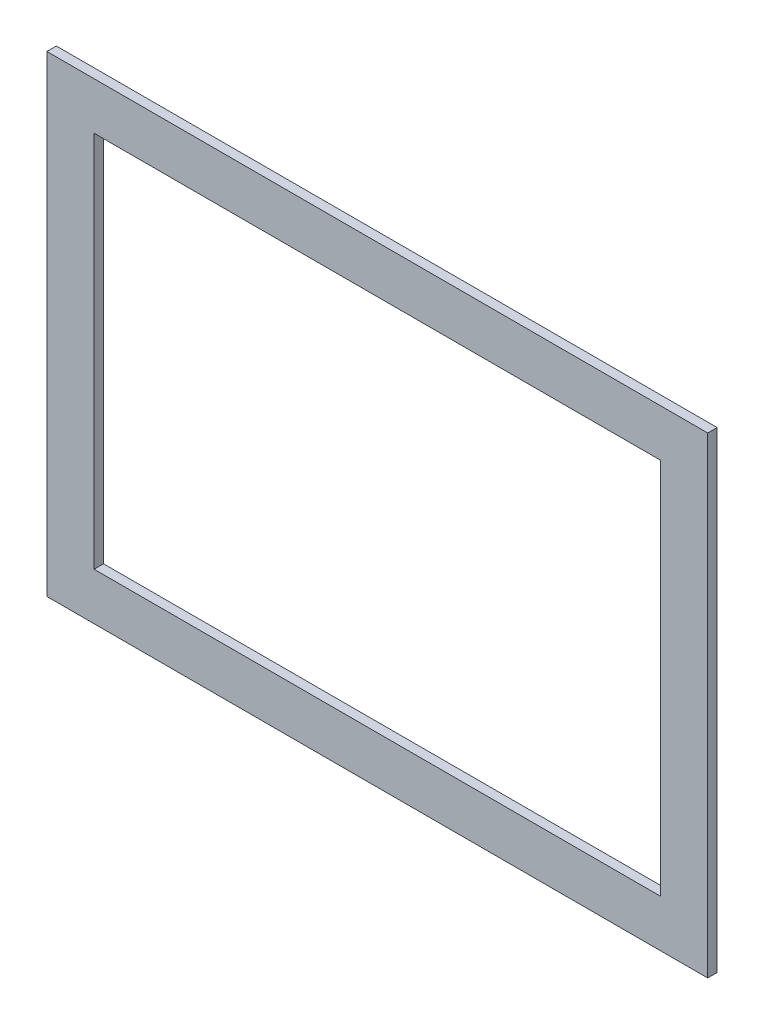
from build123d import *

# Parameters (mm, degrees)
ESQUISSE1_W             = 700
ESQUISSE1_H             = 500
BOSS_EXTRU_1_DEPTH      = 10
ESQUISSE2_W             = 600
ESQUISSE2_H             = 400
ENL_V_MAT_EXTRU_1_DEPTH = 10


with BuildPart() as part:
    # Esquisse1 → Boss.-Extru.1 (new body)
    with BuildSketch(Plane.XY):
        with Locations((-350, 250)):
            Rectangle(ESQUISSE1_W, ESQUISSE1_H)
    extrude(amount=BOSS_EXTRU_1_DEPTH)

    # Esquisse2 → Enlèv. mat.-Extru.1 (cut)
    with BuildSketch(Plane.XY.offset(10)):
        with Locations((-350, 250)):
            Rectangle(ESQUISSE2_W, ESQUISSE2_H)
    extrude(amount=-ENL_V_MAT_EXTRU_1_DEPTH, mode=Mode.SUBTRACT)


solid = part.part
